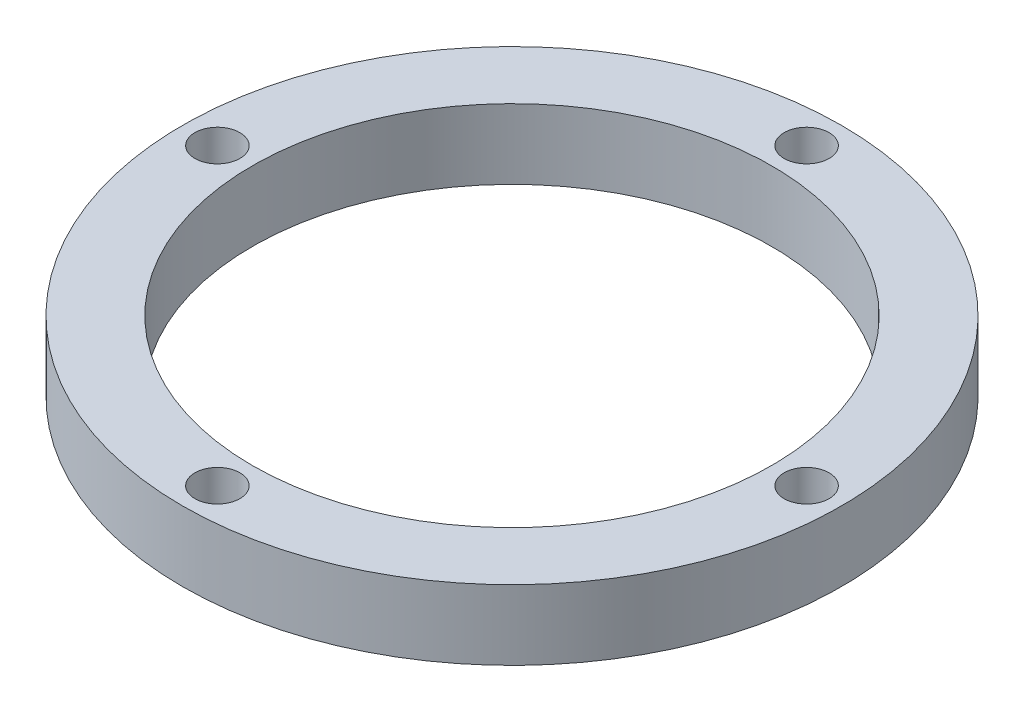
from build123d import *

# Parameters (mm, degrees)
SKETCH1_R           = 33
SKETCH1_R_2         = 26
BOSS_EXTRUDE1_DEPTH = 7
SKETCH5_R           = 2.25
CUT_EXTRUDE1_DEPTH  = 48.191100856
CIRPATTERN1_COUNT   = 4


with BuildPart() as part:
    # Sketch1 → Boss-Extrude1 (new body)
    with BuildSketch(Plane(origin=(0, 0, 0), x_dir=(1, 0, 0), z_dir=(0, 1, 0))):
        with Locations(Location((0, 0, 0), (0, 0, 270))):
            Circle(SKETCH1_R)
        with Locations(Location((0, 0, 0), (0, 0, 270))):
            Circle(SKETCH1_R_2, mode=Mode.SUBTRACT)
    extrude(amount=BOSS_EXTRUDE1_DEPTH)

    # Sketch5 → Cut-Extrude1 (cut, through all)
    with BuildSketch(Plane(origin=(0, 7, 0), x_dir=(1, 0, 0), z_dir=(0, 1, 0))):
        with Locations(Location((29.5, 0, 0), (0, 0, 270))):
            Circle(SKETCH5_R)
    cut_extrude1 = extrude(amount=-CUT_EXTRUDE1_DEPTH, mode=Mode.SUBTRACT)

    # CirPattern1: Cut-Extrude1 ×4 about axis
    cirpattern1_axis = Axis((0, 0, 0), (0, 1, 0))
    for i in range(1, CIRPATTERN1_COUNT):
        add(cut_extrude1.rotate(cirpattern1_axis, i * 360 / CIRPATTERN1_COUNT), mode=Mode.SUBTRACT)


solid = part.part
